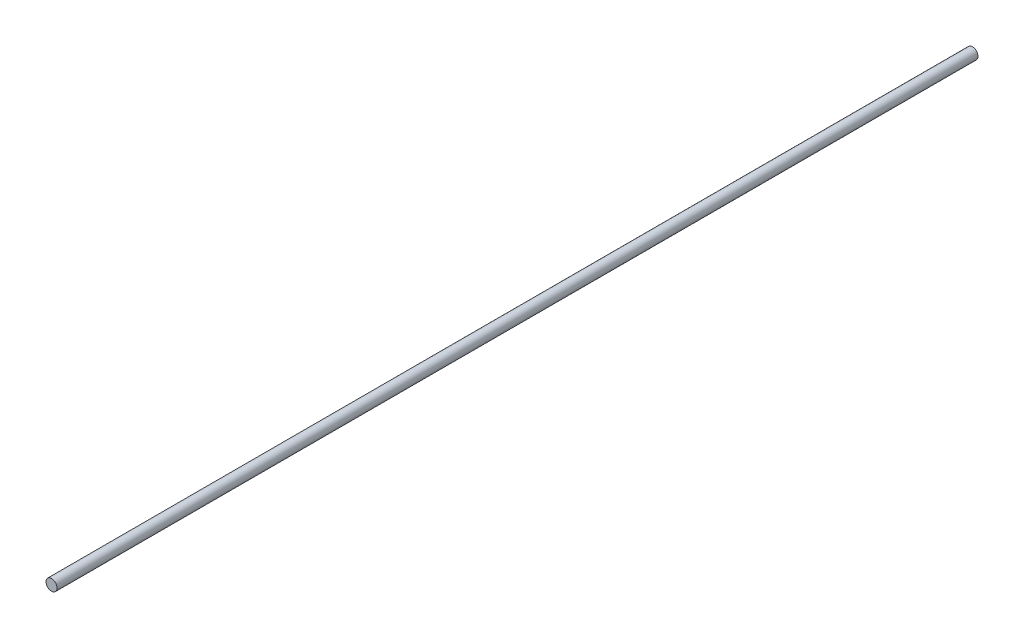
from build123d import *

# Parameters (mm, degrees)
BOSS_EXTRU_1_DEPTH      = 125
BOSS_EXTRU_1_DEPTH_BACK = 125
ESQUISSE1_R             = 1.5


with BuildPart() as part:
    # Esquisse1 → Boss.-Extru.1 (new, two sides: drawn at the far end of the back side and taken through both)
    with BuildSketch(Plane.XY.offset(-BOSS_EXTRU_1_DEPTH_BACK)):
        Circle(ESQUISSE1_R)
    extrude(amount=BOSS_EXTRU_1_DEPTH + BOSS_EXTRU_1_DEPTH_BACK)


solid = part.part
